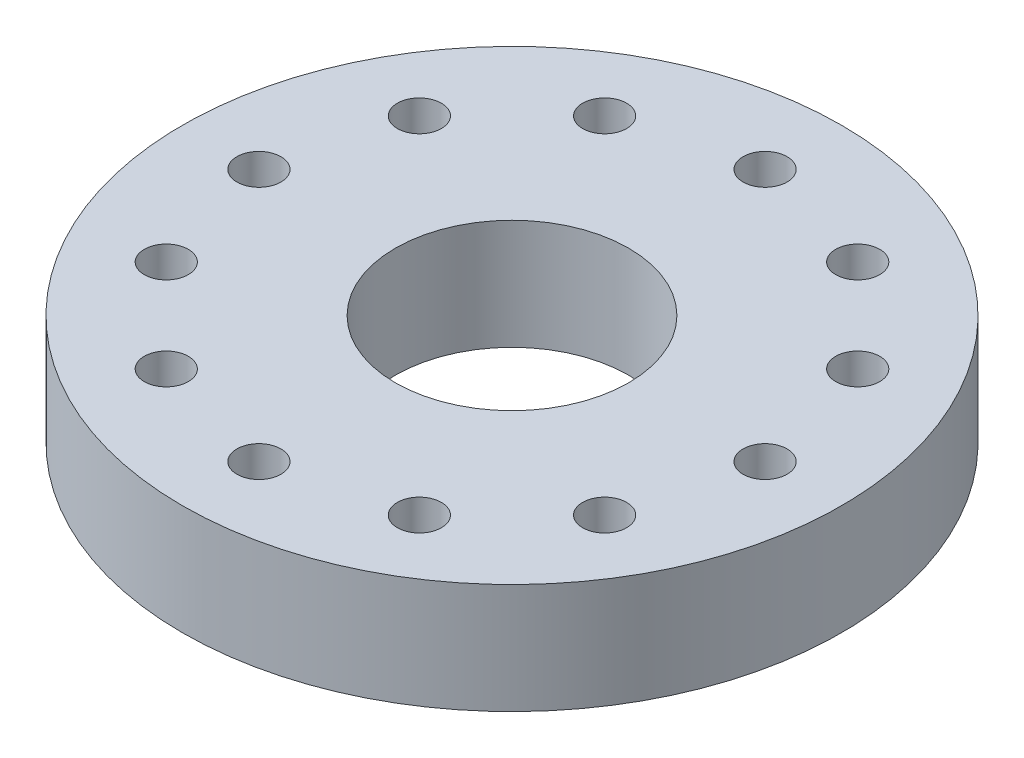
from build123d import *

# Parameters (mm, degrees)
SKETCH1_R           = 29.95
SKETCH1_R_2         = 2
SKETCH1_R_3         = 10.6
BOSS_EXTRUDE1_DEPTH = 10


with BuildPart() as part:
    # Sketch1 → Boss-Extrude1 (new body)
    with BuildSketch(Plane(origin=(0, 0, 0), x_dir=(1, 0, 0), z_dir=(0, 1, 0))):
        with Locations(Location((0, 0, 0), (0, 0, 270))):
            Circle(SKETCH1_R)
        with Locations(Location((0, 23, 0), (0, 0, 270))):
            Circle(SKETCH1_R_2, mode=Mode.SUBTRACT)
        with Locations(Location((11.5, 19.918584287, 0), (0, 0, 270))):
            Circle(SKETCH1_R_2, mode=Mode.SUBTRACT)
        with Locations(Location((19.918584287, 11.5, 0), (0, 0, 270))):
            Circle(SKETCH1_R_2, mode=Mode.SUBTRACT)
        with Locations(Location((23, 0, 0), (0, 0, 270))):
            Circle(SKETCH1_R_2, mode=Mode.SUBTRACT)
        with Locations(Location((19.918584287, -11.5, 0), (0, 0, 270))):
            Circle(SKETCH1_R_2, mode=Mode.SUBTRACT)
        with Locations(Location((11.5, -19.918584287, 0), (0, 0, 270))):
            Circle(SKETCH1_R_2, mode=Mode.SUBTRACT)
        with Locations(Location((0, 0, 0), (0, 0, 270))):
            Circle(SKETCH1_R_3, mode=Mode.SUBTRACT)
        with Locations(Location((0, -23, 0), (0, 0, 270))):
            Circle(SKETCH1_R_2, mode=Mode.SUBTRACT)
        with Locations(Location((-11.5, -19.918584287, 0), (0, 0, 270))):
            Circle(SKETCH1_R_2, mode=Mode.SUBTRACT)
        with Locations(Location((-19.918584287, -11.5, 0), (0, 0, 270))):
            Circle(SKETCH1_R_2, mode=Mode.SUBTRACT)
        with Locations(Location((-23, 0, 0), (0, 0, 270))):
            Circle(SKETCH1_R_2, mode=Mode.SUBTRACT)
        with Locations(Location((-19.918584287, 11.5, 0), (0, 0, 270))):
            Circle(SKETCH1_R_2, mode=Mode.SUBTRACT)
        with Locations(Location((-11.5, 19.918584287, 0), (0, 0, 270))):
            Circle(SKETCH1_R_2, mode=Mode.SUBTRACT)
    extrude(amount=BOSS_EXTRUDE1_DEPTH)


solid = part.part
